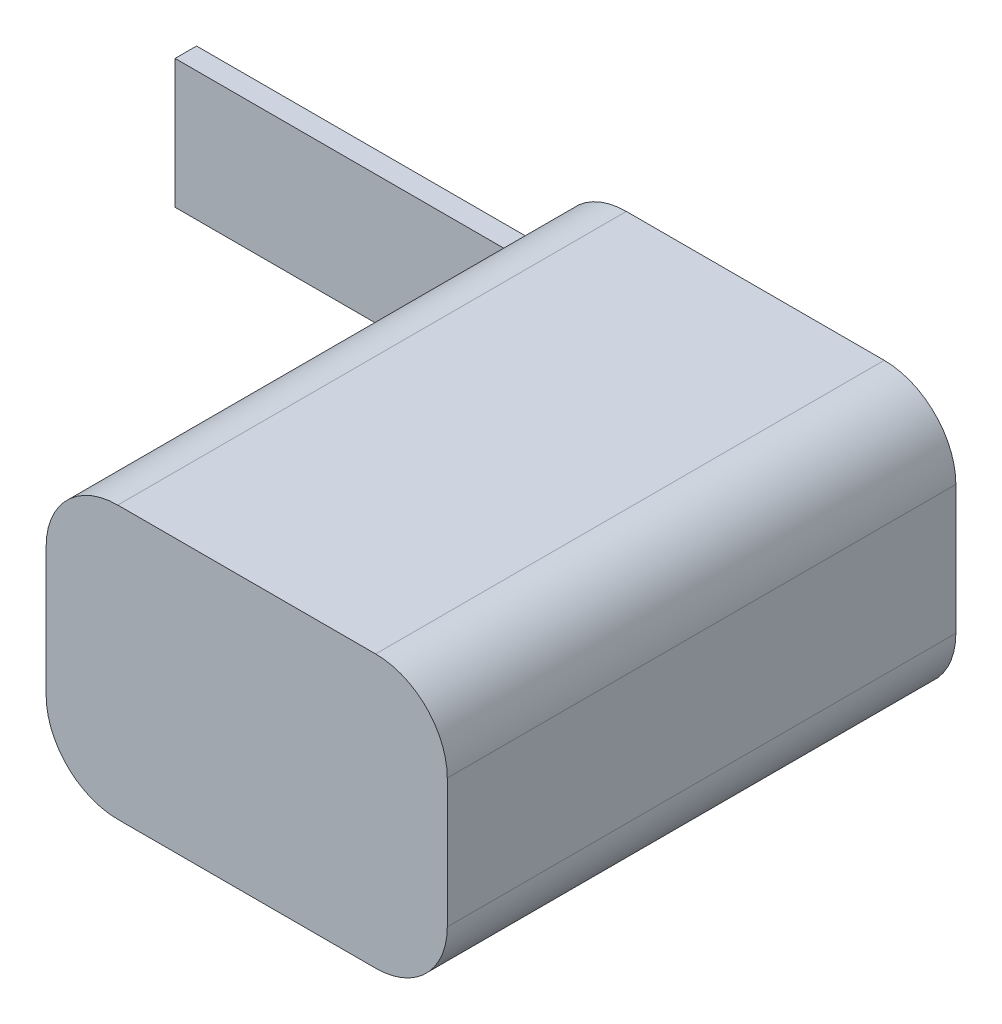
from build123d import *

# Parameters (mm, degrees)
SKETCH_1_W      = 56
SKETCH_1_H      = 38
EXTRUDE_1_DEPTH = 71
FILLET_1_R      = 10
SKETCH_2_W      = 3
SKETCH_2_H      = 18
EXTRUDE_2_DEPTH = 50


with BuildPart() as part:
    # 草图1 → 凸台-拉伸1 (new body)
    with BuildSketch(Plane.XY):
        with Locations((28, 19)):
            Rectangle(SKETCH_1_W, SKETCH_1_H)
    extrude(amount=EXTRUDE_1_DEPTH)

    # 圆角1
    fillet_1_edges = [part.edges().sort_by_distance(p)[0] for p in [
        (0, 38, 35.5),
        (56, 38, 35.5),
        (56, 0, 35.5),
        (0, 0, 35.5),
    ]]
    fillet(fillet_1_edges, radius=FILLET_1_R)

    # 草图2 → 凸台-拉伸2 (add)
    with BuildSketch(Plane.ZY):
        with Locations((1.5, 19)):
            Rectangle(SKETCH_2_W, SKETCH_2_H)
    extrude(amount=EXTRUDE_2_DEPTH)


solid = part.part
